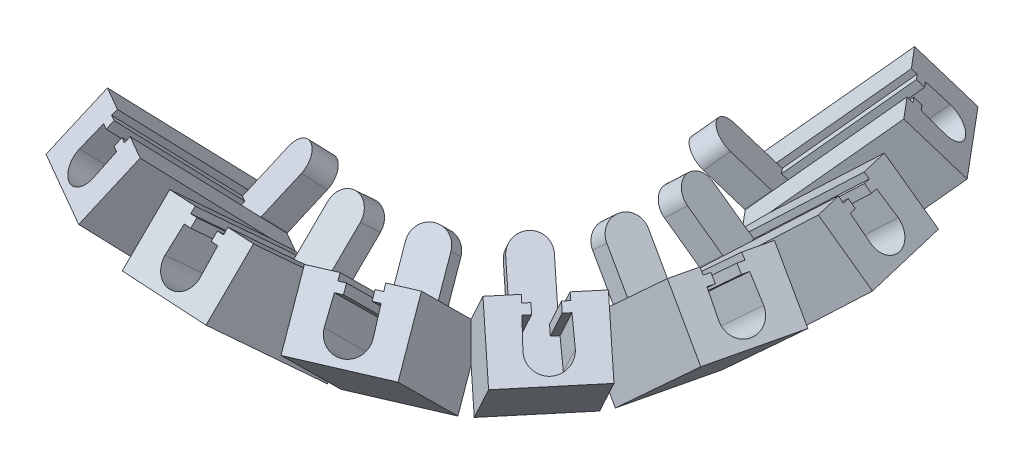
from build123d import *

# Parameters (mm, degrees)
BOSS_EXTRUDE1_DEPTH = 9
BOSS_EXTRUDE2_DEPTH = 1.5
CIRPATTERN2_COUNT   = 7
CIRPATTERN2_ANGLE   = 160


with BuildPart() as part:
    # ShuttleGuide → Boss-Extrude1 (new body)
    with BuildSketch(Plane(origin=(7.392796279, 13.932657495, -6.375760507), x_dir=(0.8233217416644961, -0.49663377739066505, 0.274765719945593), z_dir=(0.5652927788729909, 0.6741491672700942, -0.4753598367795606))):
        with BuildLine():
            Line((-0.533820675, 3.241914902), (0.631030004, 2.183734562))
            Line((0.631030004, 2.183734562), (0.864330241, 2.457252426))
            Line((0.864330241, 2.457252426), (1.148838883, 2.198797453))
            Line((1.148838883, 2.198797453), (1.485040474, 2.568889995))
            Line((1.485040474, 2.568889995), (1.18896644, 2.837851268))
            Line((1.18896644, 2.837851268), (2.162875039, 3.979647794))
            ThreePointArc((2.162875039, 3.979647794), (3.681407426, 4.052513339), (3.754272971, 2.533980951))
            Line((3.754272971, 2.533980951), (2.710972021, 1.455222223))
            Line((2.710972021, 1.455222223), (2.414897987, 1.724183496))
            Line((2.414897987, 1.724183496), (2.078696395, 1.354090954))
            Line((2.078696395, 1.354090954), (2.363205037, 1.095635981))
            Line((2.363205037, 1.095635981), (2.113281832, 0.837218849))
            Line((2.113281832, 0.837218849), (3.278132511, -0.22096149))
            Line((3.278132511, -0.22096149), (5.873155372, 2.635653804))
            Line((5.873155372, 2.635653804), (2.061202186, 6.098530196))
            Line((2.061202186, 6.098530196), (-0.533820675, 3.241914902))
        make_face()
    boss_extrude1 = extrude(amount=BOSS_EXTRUDE1_DEPTH)

    # ShuttleGuide<3> → Boss-Extrude2 (add)
    with BuildSketch(Plane(origin=(7.392796279, 13.932657495, -6.375760507), x_dir=(0.8233217416644961, -0.49663377739066505, 0.274765719945593), z_dir=(0.5652927788729909, 0.6741491672700942, -0.4753598367795606))):
        with BuildLine():
            Line((-0.740185085, 0.672403183), (-1.076386676, 0.302310641))
            ThreePointArc((-1.076386676, 0.302310641), (-1.008604774, -1.110277627), (0.403983493, -1.042495725))
            Line((0.403983493, -1.042495725), (0.740185085, -0.672403183))
            Line((0.740185085, -0.672403183), (2.084991451, 0.807966986))
            Line((2.084991451, 0.807966986), (2.363205037, 1.095635981))
            Line((2.363205037, 1.095635981), (2.078696395, 1.354090954))
            Line((2.078696395, 1.354090954), (2.414897987, 1.724183496))
            Line((2.414897987, 1.724183496), (2.710972021, 1.455222223))
            Line((2.710972021, 1.455222223), (3.754272971, 2.533980951))
            ThreePointArc((3.754272971, 2.533980951), (3.681407426, 4.052513339), (2.162875039, 3.979647794))
            Line((2.162875039, 3.979647794), (1.18896644, 2.837851268))
            Line((1.18896644, 2.837851268), (1.485040474, 2.568889995))
            Line((1.485040474, 2.568889995), (1.148838883, 2.198797453))
            Line((1.148838883, 2.198797453), (0.864330241, 2.457252426))
            Line((0.864330241, 2.457252426), (0.604621281, 2.152773352))
            Line((0.604621281, 2.152773352), (-0.740185085, 0.672403183))
        make_face()
    boss_extrude2 = extrude(amount=BOSS_EXTRUDE2_DEPTH)

    # CirPattern2: Boss-Extrude1, Boss-Extrude2 ×7 about axis
    cirpattern2_axis = Axis((1, 0, -1), (0, -1, 0))
    add([boss_extrude1.rotate(cirpattern2_axis, i * CIRPATTERN2_ANGLE / (CIRPATTERN2_COUNT - 1)) for i in range(1, CIRPATTERN2_COUNT)])
    add([boss_extrude2.rotate(cirpattern2_axis, i * CIRPATTERN2_ANGLE / (CIRPATTERN2_COUNT - 1)) for i in range(1, CIRPATTERN2_COUNT)])


solid = part.part
